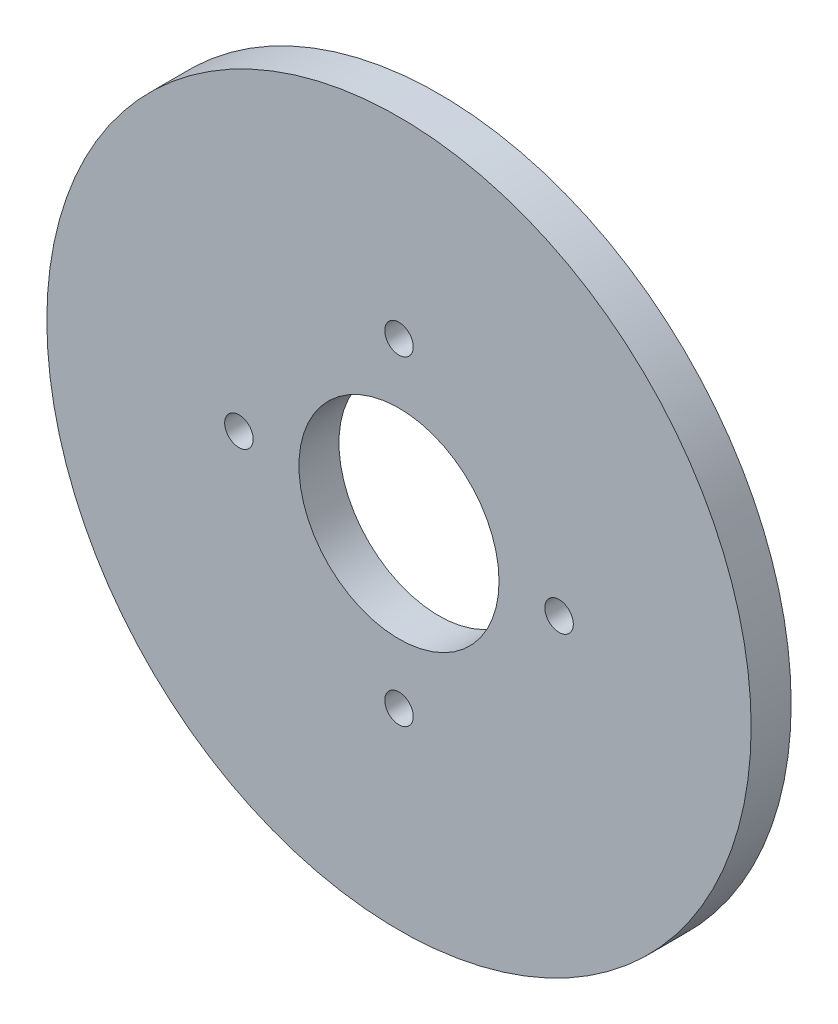
from build123d import *

# Parameters (mm, degrees)
SKETCH1_R                     = 27.94
SKETCH1_R_2                   = 7.9375
BOSS_EXTRUDE1_DEPTH           = 3.175
TAP_DRILL_FOR_4_40_TAP1_D     = 2.2606
TAP_DRILL_FOR_4_40_TAP1_DEPTH = 4
TAP_DRILL_FOR_4_40_TAP1_TIP   = 0.679152758


with BuildPart() as part:
    # Sketch1 → Boss-Extrude1 (new body)
    with BuildSketch(Plane.XY):
        Circle(SKETCH1_R)
        Circle(SKETCH1_R_2, mode=Mode.SUBTRACT)
    extrude(amount=BOSS_EXTRUDE1_DEPTH)

    # Tap Drill for #4-40 Tap1
    with Locations(Plane.XY.offset(3.175)):
        with Locations((0, 12.7), (0, -12.7), (12.7, 0), (-12.7, 0)):
            Hole(TAP_DRILL_FOR_4_40_TAP1_D / 2, depth=TAP_DRILL_FOR_4_40_TAP1_DEPTH)
            with Locations((0, 0, -(TAP_DRILL_FOR_4_40_TAP1_DEPTH + TAP_DRILL_FOR_4_40_TAP1_TIP / 2))):  # 118° drill point
                Cone(0, TAP_DRILL_FOR_4_40_TAP1_D / 2, TAP_DRILL_FOR_4_40_TAP1_TIP, mode=Mode.SUBTRACT)


solid = part.part
